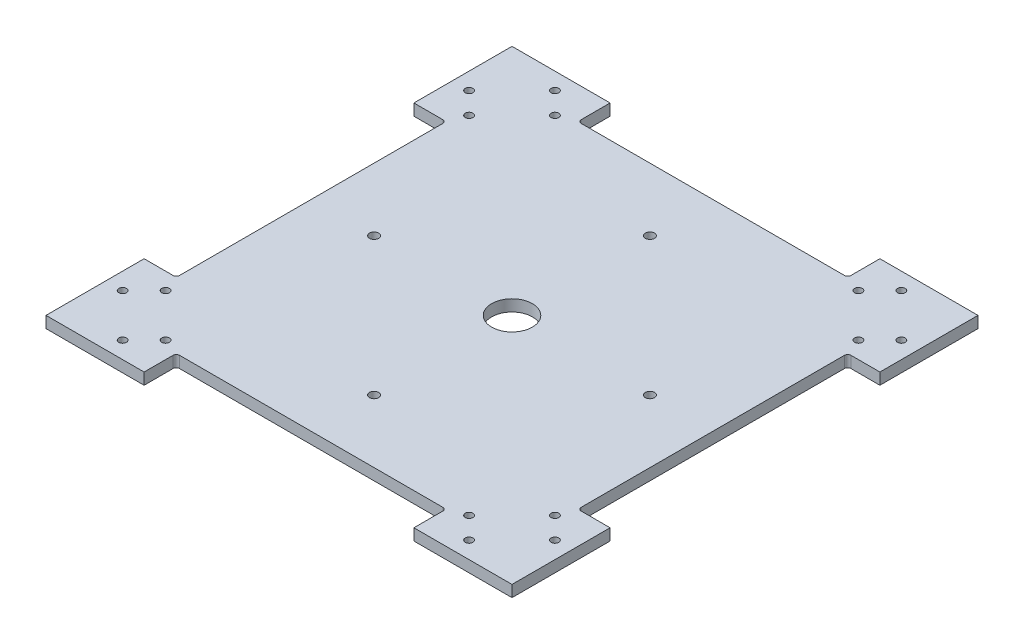
from build123d import *

# Parameters (mm, degrees)
BOSS_EXTRUDE1_DEPTH             = 11.90625
FILLET1_R                       = 3.3782
FOR_CONNECTION_TO_DONUT_D       = 9.525
F_5_16_0_3125_DIAMETER_HOLE1_D  = 7.9375
CIRPATTERN1_COUNT               = 4
SKETCH14_R                      = 21.082
HOLE_FOR_WHEEL_ON_A_STICK_DEPTH = 342.457374776


with BuildPart() as part:
    # Sketch2 → Boss-Extrude1 (new body)
    with BuildSketch(Plane(origin=(0, 0, 0), x_dir=(1, 0, 0), z_dir=(0, 1, 0))):
        Polygon((-241.3, 241.3), (-139.7, 241.3), (-139.7, 207.9625), (139.7, 207.9625), (139.7, 241.3), (241.3, 241.3), (241.3, 139.7), (207.9625, 139.7), (207.9625, -139.7), (241.3, -139.7), (241.3, -241.3), (139.7, -241.3), (139.7, -207.9625), (-139.7, -207.9625), (-139.7, -241.3), (-241.3, -241.3), (-241.3, -139.7), (-207.9625, -139.7), (-207.9625, 139.7), (-241.3, 139.7), align=None)
    extrude(amount=-BOSS_EXTRUDE1_DEPTH)

    # Fillet1
    fillet1_edges = [part.edges().sort_by_distance(p)[0] for p in [
        (-139.7, -5.953125, -207.9625),
        (139.7, -5.953125, -207.9625),
        (207.9625, -5.953125, -139.7),
        (207.9625, -5.953125, 139.7),
        (139.7, -5.953125, 207.9625),
        (-139.7, -5.953125, 207.9625),
        (-207.9625, -5.953125, 139.7),
        (-207.9625, -5.953125, -139.7),
    ]]
    fillet(fillet1_edges, radius=FILLET1_R)

    # for connection to donut (through all)
    with Locations(Plane(origin=(0, -11.90625, 0), x_dir=(-1, 0, 0), z_dir=(0, -1, 0))):
        with Locations((0, -142.875), (142.875, 0), (0, 142.875), (-142.875, 0)):
            Hole(FOR_CONNECTION_TO_DONUT_D / 2)

    # 5/16 (0.3125) Diameter Hole1 (through all)
    with Locations(Plane(origin=(0, -11.90625, 0), x_dir=(-1, 0, 0), z_dir=(0, -1, 0))):
        with Locations((-157.1625, 201.6125), (-179.3875, 223.8375), (-223.8375, 179.3875), (-201.6125, 157.1625)):
            f_5_16_0_3125_diameter_hole1 = Hole(F_5_16_0_3125_DIAMETER_HOLE1_D / 2)

    # CirPattern1: 5/16 (0.3125) Diameter Hole1 ×4 about axis
    cirpattern1_axis = Axis((0, 0, 0), (0, 1, 0))
    for i in range(1, CIRPATTERN1_COUNT):
        add(f_5_16_0_3125_diameter_hole1.rotate(cirpattern1_axis, i * 360 / CIRPATTERN1_COUNT), mode=Mode.SUBTRACT)

    # Sketch14 → hole for wheel on a stick (cut, through all)
    with BuildSketch(Plane(origin=(0, 0, 0), x_dir=(1, 0, 0), z_dir=(0, 1, 0))):
        with Locations(Location((0, 0, 0), (0, 0, 270))):
            Circle(SKETCH14_R)
    extrude(amount=-HOLE_FOR_WHEEL_ON_A_STICK_DEPTH, mode=Mode.SUBTRACT)


solid = part.part
